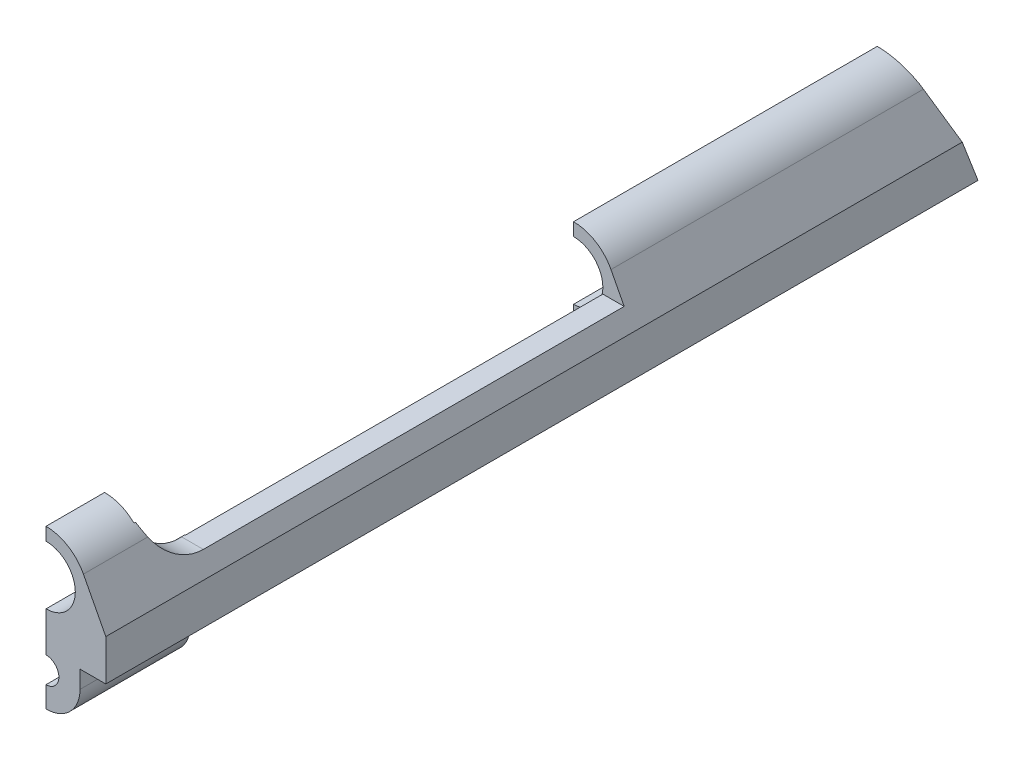
from build123d import *

# Parameters (mm, degrees)
SKETCH1_W                = 188.976
SKETCH1_H                = 34.29
BOSS_EXTRUDE1_DEPTH      = 12.954
CUT_EXTRUDE1_DEPTH       = 121.412
CUT_EXTRUDE2_DEPTH       = 25.4
SKETCH3_W                = 165.1
SKETCH3_H                = 11.176
CUT_EXTRUDE3_DEPTH       = 193.498152698
CUT_EXTRUDE4_DEPTH       = 25.4
SKETCH5_W                = 6.35
SKETCH5_H                = 90.424
CUT_EXTRUDE6_DEPTH       = 193.498152698
SKETCH5_4_W              = 6.35
SKETCH5_4_H              = 11.176
CUT_EXTRUDE7_DEPTH       = 10.414
CUT_EXTRUDE8_DEPTH       = 193.498152698
CUT_EXTRUDE9_DEPTH       = 193.17529886
CUT_EXTRUDE10_DEPTH      = 193.498152715
CUT_EXTRUDE10_DEPTH_BACK = 193.498152715
CUT_EXTRUDE12_DEPTH      = 67.31


with BuildPart() as part:
    # Sketch1 → Boss-Extrude1 (new body)
    with BuildSketch(Plane(origin=(0, 0, 0), x_dir=(0, 0, -1), z_dir=(1, 0, 0))):
        with Locations((94.488, 17.145)):
            Rectangle(SKETCH1_W, SKETCH1_H)
    extrude(amount=BOSS_EXTRUDE1_DEPTH)

    # Sketch2 → Cut-Extrude1 (cut)
    with BuildSketch(Plane.XY):
        with BuildLine():
            Line((0, 31.496), (0, 18.796))
            ThreePointArc((0, 18.796), (4.490128061, 20.655871939), (6.35, 25.146))
            ThreePointArc((6.35, 25.146), (4.490128061, 29.636128061), (0, 31.496))
        make_face()
    extrude(amount=-CUT_EXTRUDE1_DEPTH, mode=Mode.SUBTRACT)

    # Sketch2<3> → Cut-Extrude2 (cut)
    with BuildSketch(Plane.XY):
        with BuildLine():
            ThreePointArc((0, 4.572), (1.975656347, 5.390343653), (2.794, 7.366))
            ThreePointArc((2.794, 7.366), (1.975656347, 9.341656347), (0, 10.16))
            Line((0, 10.16), (0, 4.572))
        make_face()
    extrude(amount=-CUT_EXTRUDE2_DEPTH, mode=Mode.SUBTRACT)

    # Sketch3 → Cut-Extrude3 (cut, through all)
    with BuildSketch(Plane.ZY):
        with Locations((-106.426, 5.588)):
            Rectangle(SKETCH3_W, SKETCH3_H)
    extrude(amount=-CUT_EXTRUDE3_DEPTH, mode=Mode.SUBTRACT)

    # Sketch4 → Cut-Extrude4 (cut)
    with BuildSketch(Plane.XY):
        with BuildLine():
            Line((7.366, 11.176), (7.366, 7.366))
            ThreePointArc((7.366, 7.366), (5.20854855, 2.15745145), (0, 0))
            Line((0, 0), (12.954, 0))
            Line((12.954, 0), (12.954, 11.176))
            Line((12.954, 11.176), (7.366, 11.176))
        make_face()
    extrude(amount=-CUT_EXTRUDE4_DEPTH, mode=Mode.SUBTRACT)

    # Sketch5 → Cut-Extrude6 (cut, through all)
    with BuildSketch(Plane(origin=(0, 34.29, 0), x_dir=(1, 0, 0), z_dir=(0, 1, 0))):
        with Locations((3.175, 69.088)):
            Rectangle(SKETCH5_W, SKETCH5_H)
    extrude(amount=-CUT_EXTRUDE6_DEPTH, mode=Mode.SUBTRACT)

    # Sketch5<4> → Cut-Extrude7 (cut)
    with BuildSketch(Plane(origin=(0, 34.29, 0), x_dir=(1, 0, 0), z_dir=(0, 1, 0))):
        with Locations((3.175, 18.288)):
            Rectangle(SKETCH5_4_W, SKETCH5_4_H)
    extrude(amount=-CUT_EXTRUDE7_DEPTH, mode=Mode.SUBTRACT)

    # Sketch6 → Cut-Extrude8 (cut, through all)
    with BuildSketch(Plane.XY):
        with BuildLine():
            ThreePointArc((0, 34.29), (4.74341842, 32.963462356), (8.110563197, 29.368736153))
            Line((8.110563197, 29.368736153), (12.954, 20.066))
            Line((12.954, 20.066), (12.954, 34.29))
            Line((12.954, 34.29), (0, 34.29))
        make_face()
    extrude(amount=-CUT_EXTRUDE8_DEPTH, mode=Mode.SUBTRACT)

    # Sketch7 → Cut-Extrude9 (cut, through all)
    with BuildSketch(Plane.ZY.offset(-6.35)):
        with BuildLine():
            Line((-114.3, 34.29), (-114.3, 23.876))
            Line((-114.3, 23.876), (-23.114000049, 23.876))
            ThreePointArc((-23.114000049, 23.876), (-15.750189998, 26.926189963), (-12.7, 34.29))
            Line((-12.7, 34.29), (-114.3, 34.29))
        make_face()
    extrude(amount=-CUT_EXTRUDE9_DEPTH, mode=Mode.SUBTRACT)

    # Sketch8 → Cut-Extrude10 (cut, two sides: drawn at the far end of the back side and taken through both)
    with BuildSketch(Plane.ZY.offset(-CUT_EXTRUDE10_DEPTH_BACK)):
        Polygon((-188.976, 34.29), (-188.976, 11.176), (-180.103366694, 34.29), align=None)
    extrude(amount=CUT_EXTRUDE10_DEPTH + CUT_EXTRUDE10_DEPTH_BACK, mode=Mode.SUBTRACT)

    # Sketch12 → Cut-Extrude12 (cut)
    with BuildSketch(Plane.XY.offset(-188.976)):
        Polygon((0, 11.176), (8.382, 11.176), (8.382, 13.97), (10.922, 13.97), (10.922, 18.542), (0, 18.542), align=None)
    extrude(amount=CUT_EXTRUDE12_DEPTH, mode=Mode.SUBTRACT)


solid = part.part
